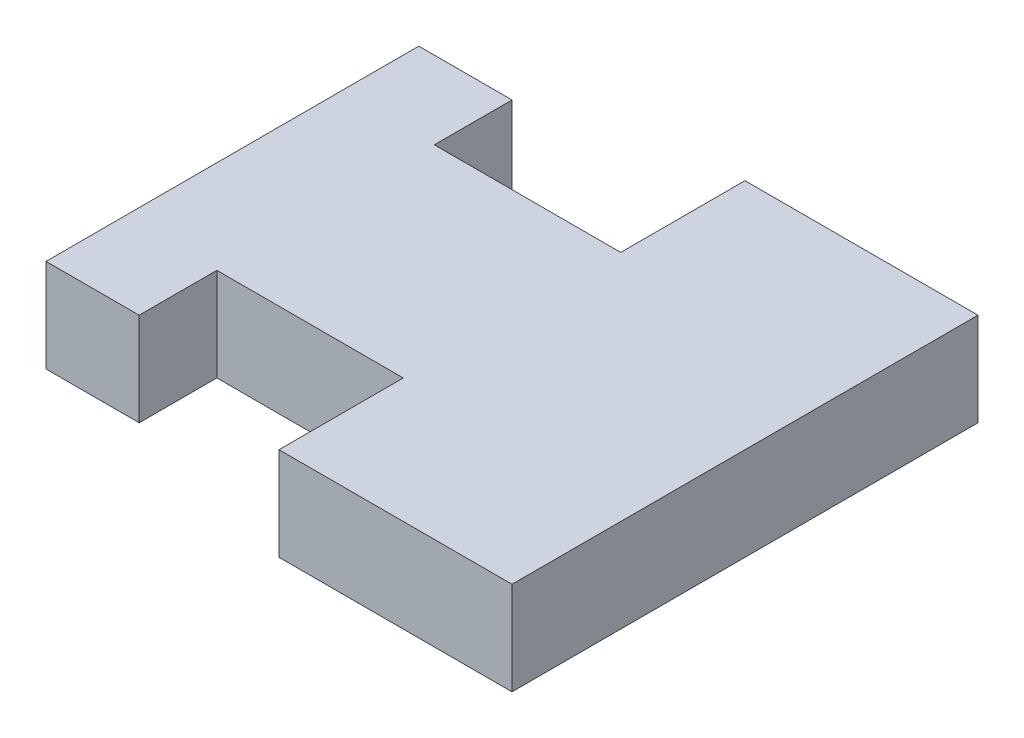
from build123d import *

# Parameters (mm, degrees)
BOSS_EXTRUDE1_DEPTH = 0.3


with BuildPart() as part:
    # Sketch1 → Boss-Extrude1 (new body)
    with BuildSketch(Plane(origin=(0, 0, 0), x_dir=(1, 0, 0), z_dir=(0, 1, 0))):
        Polygon((0, 1.5), (-0.75, 1.5), (-0.75, 1.1), (-1.35, 1.1), (-1.35, 1.35), (-1.65, 1.35), (-1.65, 0.15), (-1.35, 0.15), (-1.35, 0.4), (-0.75, 0.4), (-0.75, 0), (0, 0), align=None)
    extrude(amount=BOSS_EXTRUDE1_DEPTH)


solid = part.part
